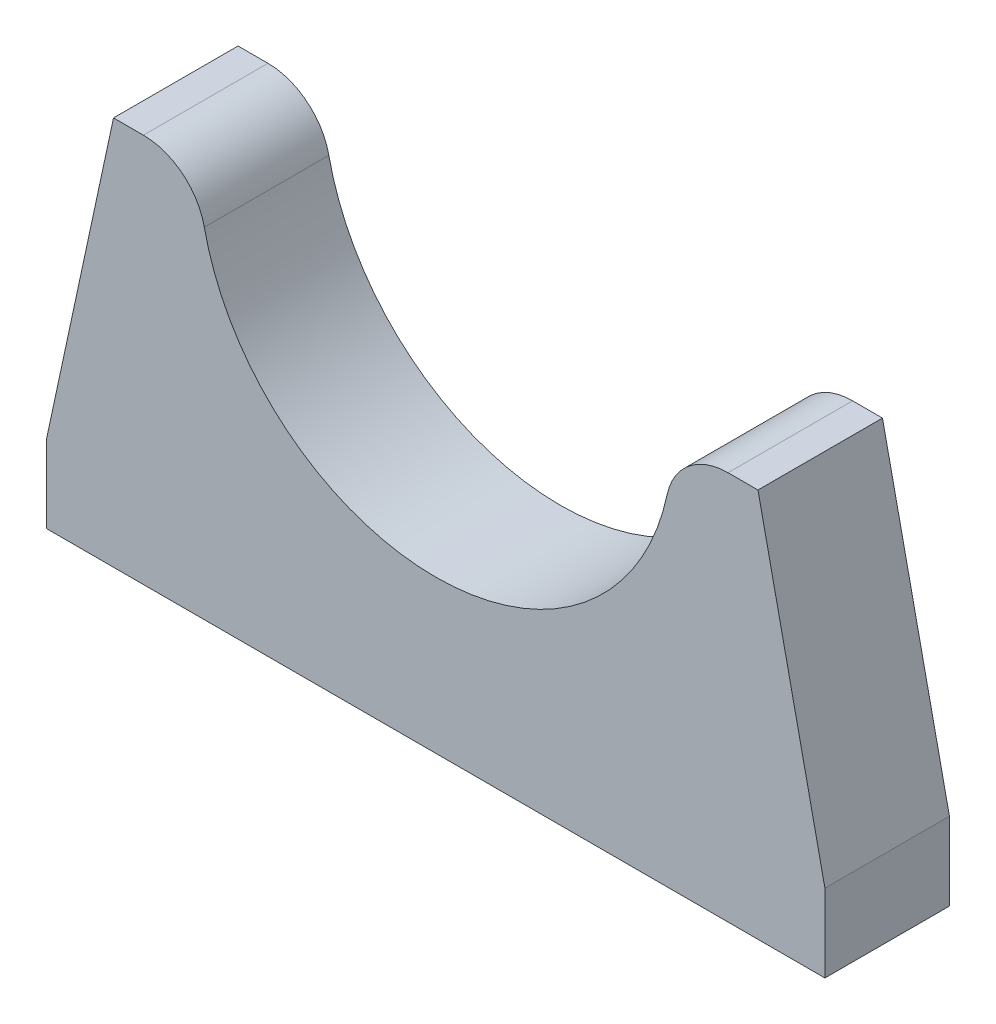
from build123d import *

# Parameters (mm, degrees)
BOSS_EXTRU_1_DEPTH      = 8
CONG_1_R                = 4
ESQUISSE2_R             = 1.25
ENL_V_MAT_EXTRU_1_DEPTH = 8


with BuildPart() as part:
    # Esquisse1 → Boss.-Extru.1 (new body)
    with BuildSketch(Plane.XY):
        with BuildLine():
            Line((9.8, 25), (4.3, 25))
            Line((4.3, 25), (0, 5))
            Line((0, 5), (0, 0))
            Line((0, 0), (50, 0))
            Line((50, 0), (50, 5))
            Line((50, 5), (45.7, 25))
            Line((45.7, 25), (40.2, 25))
            ThreePointArc((40.2, 25), (25, 9.8), (9.8, 25))
        make_face()
    extrude(amount=BOSS_EXTRU_1_DEPTH)

    # Congé1
    cong_1_edges = [part.edges().sort_by_distance(p)[0] for p in [
        (40.2, 25, 4),
        (9.8, 25, 4),
    ]]
    fillet(cong_1_edges, radius=CONG_1_R)

    # Esquisse2 → Enlèv. mat.-Extru.1 (cut)
    with BuildSketch(Plane.XZ):
        with Locations(Location((5, 4, 0), (0, 0, 270))):
            Circle(ESQUISSE2_R)
        with Locations(Location((45, 4, 0), (0, 0, 90))):
            Circle(ESQUISSE2_R)
    extrude(amount=-ENL_V_MAT_EXTRU_1_DEPTH, mode=Mode.SUBTRACT)


solid = part.part
